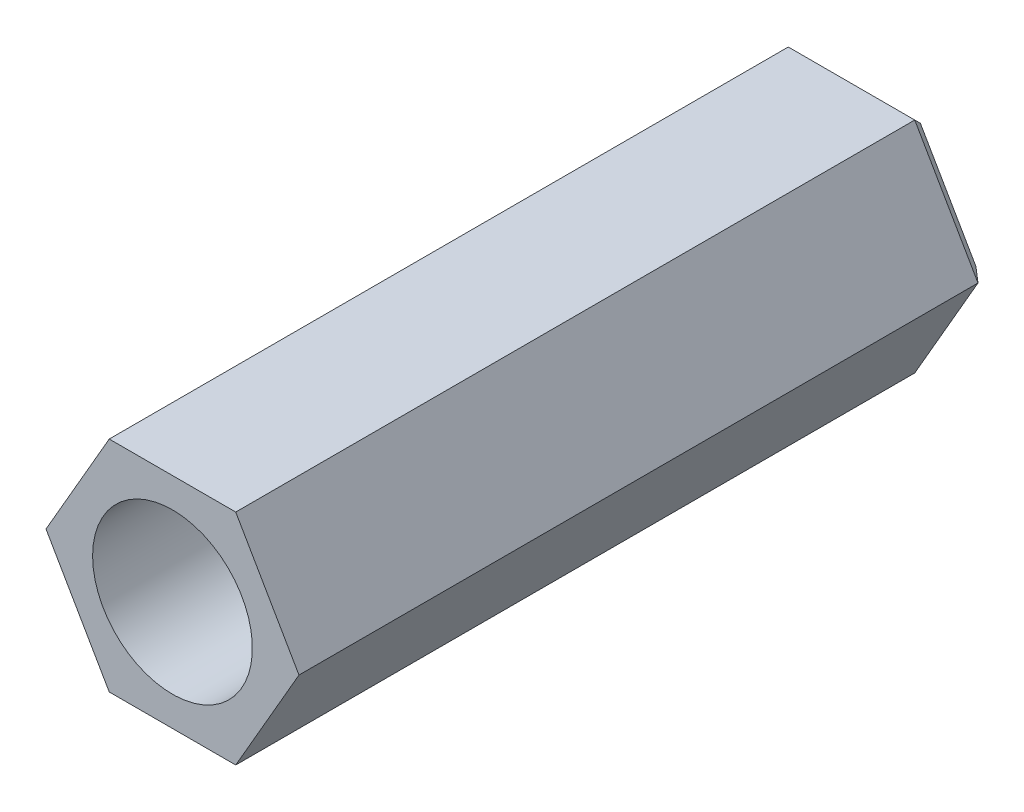
from build123d import *

# Parameters (mm, degrees)
ESQUISSE1_R        = 1.5
BOSS_EXTRU_1_DEPTH = 13
CHANFREIN1_SIZE    = 0.25


with BuildPart() as part:
    # Esquisse1 → Boss.-Extru.1 (new body)
    with BuildSketch(Plane.XY):
        Polygon((-1.1875, -2.056810334), (1.1875, -2.056810334), (2.375, 0), (1.1875, 2.056810334), (-1.1875, 2.056810334), (-2.375, 0), align=None)
        with Locations(Location((0, 0, 0), (0, 0, 180))):
            Circle(ESQUISSE1_R, mode=Mode.SUBTRACT)
    extrude(amount=BOSS_EXTRU_1_DEPTH)

    # Chanfrein1
    chanfrein1_edges = [part.edges().sort_by_distance(p)[0] for p in [
        (-1.78125, 1.028405167, 0),
        (0, 2.056810334, 0),
        (1.78125, 1.028405167, 0),
        (1.78125, -1.028405167, 0),
        (0, -2.056810334, 0),
        (-1.78125, -1.028405167, 0),
    ]]
    chamfer(chanfrein1_edges, length=CHANFREIN1_SIZE)


solid = part.part
